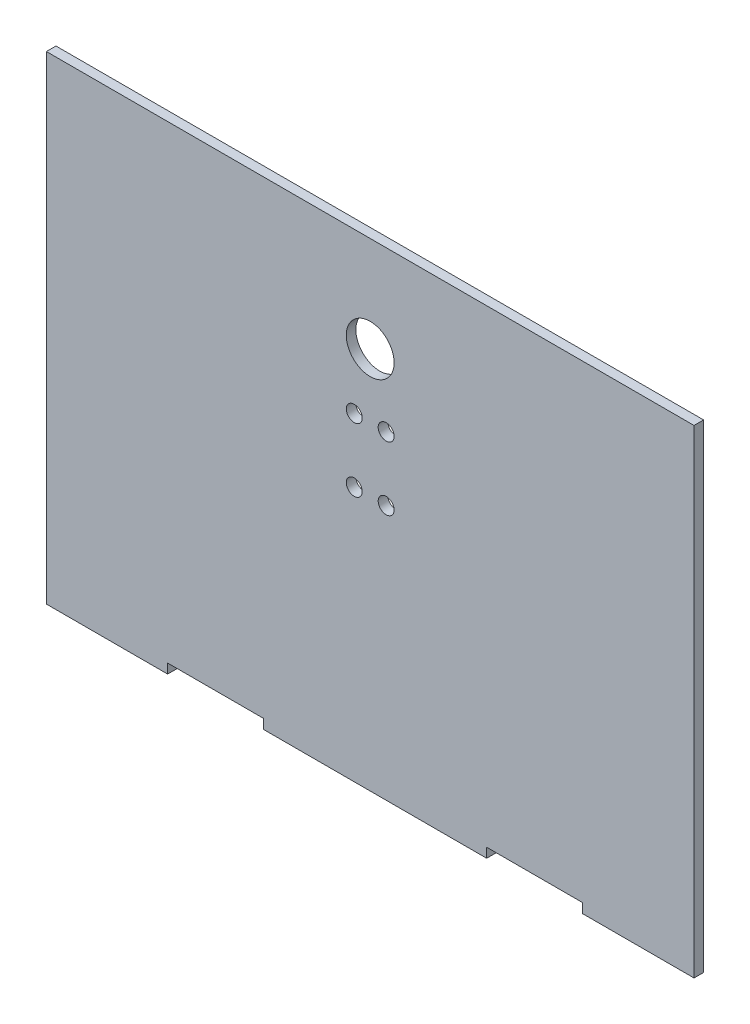
from build123d import *

# Parameters (mm, degrees)
SKETCH1_W           = 203
SKETCH1_H           = 150
BOSS_EXTRUDE1_DEPTH = 3
SKETCH3_R           = 7.5
SKETCH3_R_2         = 2.5
CUT_EXTRUDE2_DEPTH  = 10
SKETCH4_W           = 30
SKETCH4_H           = 3
CUT_EXTRUDE3_DEPTH  = 10


with BuildPart() as part:
    # Sketch1 → Boss-Extrude1 (new body)
    with BuildSketch(Plane.XY):
        Rectangle(SKETCH1_W, SKETCH1_H)
    extrude(amount=BOSS_EXTRUDE1_DEPTH)

    # Sketch3 → Cut-Extrude2 (cut)
    with BuildSketch(Plane.XY.offset(3)):
        with Locations((0, 45)):
            Circle(SKETCH3_R)
        with Locations((-5, 25)):
            Circle(SKETCH3_R_2)
        with Locations((-5, 5)):
            Circle(SKETCH3_R_2)
        with Locations((5, 5)):
            Circle(SKETCH3_R_2)
        with Locations((5, 25)):
            Circle(SKETCH3_R_2)
    extrude(amount=-CUT_EXTRUDE2_DEPTH, mode=Mode.SUBTRACT)

    # Sketch4 → Cut-Extrude3 (cut)
    with BuildSketch(Plane.XY.offset(3)):
        with Locations((-48.5, -73.5)):
            Rectangle(SKETCH4_W, SKETCH4_H)
        with Locations((51.5, -73.5)):
            Rectangle(SKETCH4_W, SKETCH4_H)
    extrude(amount=-CUT_EXTRUDE3_DEPTH, mode=Mode.SUBTRACT)


solid = part.part
